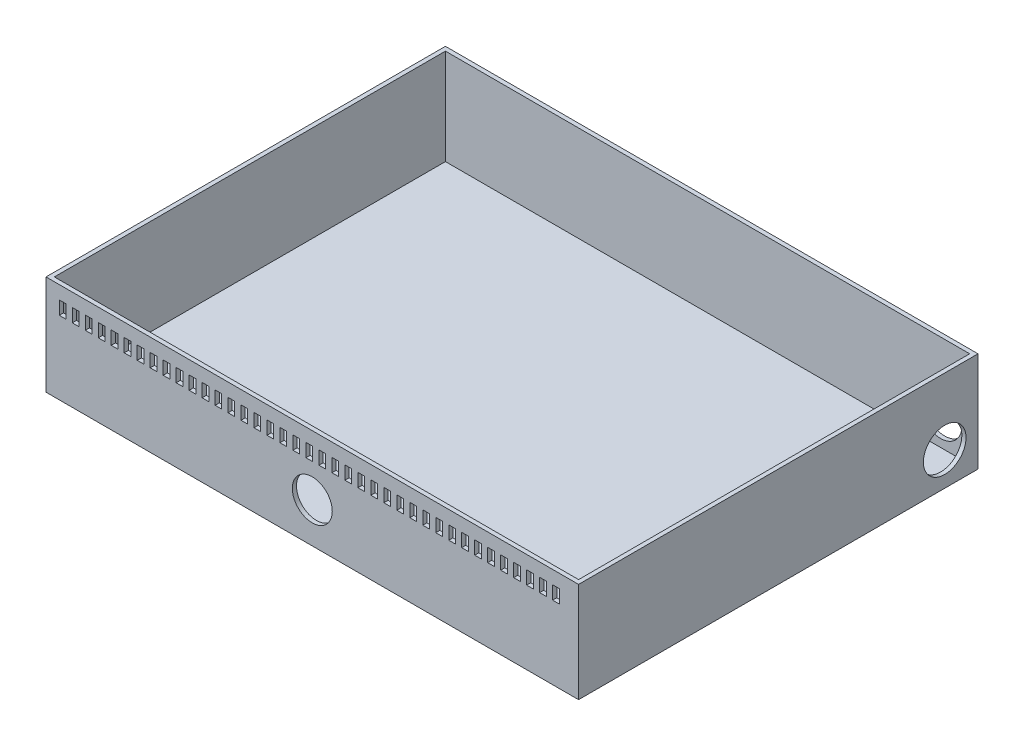
from build123d import *

# Parameters (mm, degrees)
SKETCH1_W           = 203.2
SKETCH1_H           = 152.4
BOSS_EXTRUDE1_DEPTH = 38.1
SKETCH2_W           = 200.025
SKETCH2_H           = 149.225
CUT_EXTRUDE1_DEPTH  = 36.5125
SKETCH3_W           = 2.54
SKETCH3_H           = 5.08
CUT_EXTRUDE2_DEPTH  = 7.62
LPATTERN1_COUNT     = 39
LPATTERN1_PITCH     = 4.953
SKETCH4_R           = 7.62
CUT_EXTRUDE3_DEPTH  = 7.62
SKETCH5_R           = 8.128
CUT_EXTRUDE4_DEPTH  = 7.62
SKETCH6_R           = 8.128
CUT_EXTRUDE5_DEPTH  = 7.62


with BuildPart() as part:
    # Sketch1 → Boss-Extrude1 (new body)
    with BuildSketch(Plane(origin=(0, 0, 0), x_dir=(1, 0, 0), z_dir=(0, 1, 0))):
        Rectangle(SKETCH1_W, SKETCH1_H)
    extrude(amount=BOSS_EXTRUDE1_DEPTH)

    # Sketch2 → Cut-Extrude1 (cut)
    with BuildSketch(Plane(origin=(0, 38.1, 0), x_dir=(1, 0, 0), z_dir=(0, 1, 0))):
        Rectangle(SKETCH2_W, SKETCH2_H)
    extrude(amount=-CUT_EXTRUDE1_DEPTH, mode=Mode.SUBTRACT)

    # Sketch3 → Cut-Extrude2 (cut)
    with BuildSketch(Plane.XY.offset(76.2)):
        with Locations((-95.25, 30.48)):
            Rectangle(SKETCH3_W, SKETCH3_H)
    cut_extrude2 = extrude(amount=-CUT_EXTRUDE2_DEPTH, mode=Mode.SUBTRACT)

    # LPattern1: Cut-Extrude2 ×39
    with Locations(*[(i * LPATTERN1_PITCH, 0, 0) for i in range(1, LPATTERN1_COUNT)]):
        add(cut_extrude2, mode=Mode.SUBTRACT)

    # Sketch4 → Cut-Extrude3 (cut)
    with BuildSketch(Plane.XY.offset(76.2)):
        with Locations((0, 15.24)):
            Circle(SKETCH4_R)
    extrude(amount=-CUT_EXTRUDE3_DEPTH, mode=Mode.SUBTRACT)

    # Sketch5 → Cut-Extrude4 (cut)
    with BuildSketch(Plane(origin=(101.6, 0, 0), x_dir=(0, 0, -1), z_dir=(1, 0, 0))):
        with Locations((63.5, 12.7)):
            Circle(SKETCH5_R)
    extrude(amount=-CUT_EXTRUDE4_DEPTH, mode=Mode.SUBTRACT)

    # Sketch6 → Cut-Extrude5 (cut)
    with BuildSketch(Plane(origin=(0, 0, -76.2), x_dir=(-1, 0, 0), z_dir=(0, 0, -1))):
        with Locations((-88.9, 12.7)):
            Circle(SKETCH6_R)
    extrude(amount=-CUT_EXTRUDE5_DEPTH, mode=Mode.SUBTRACT)


solid = part.part
